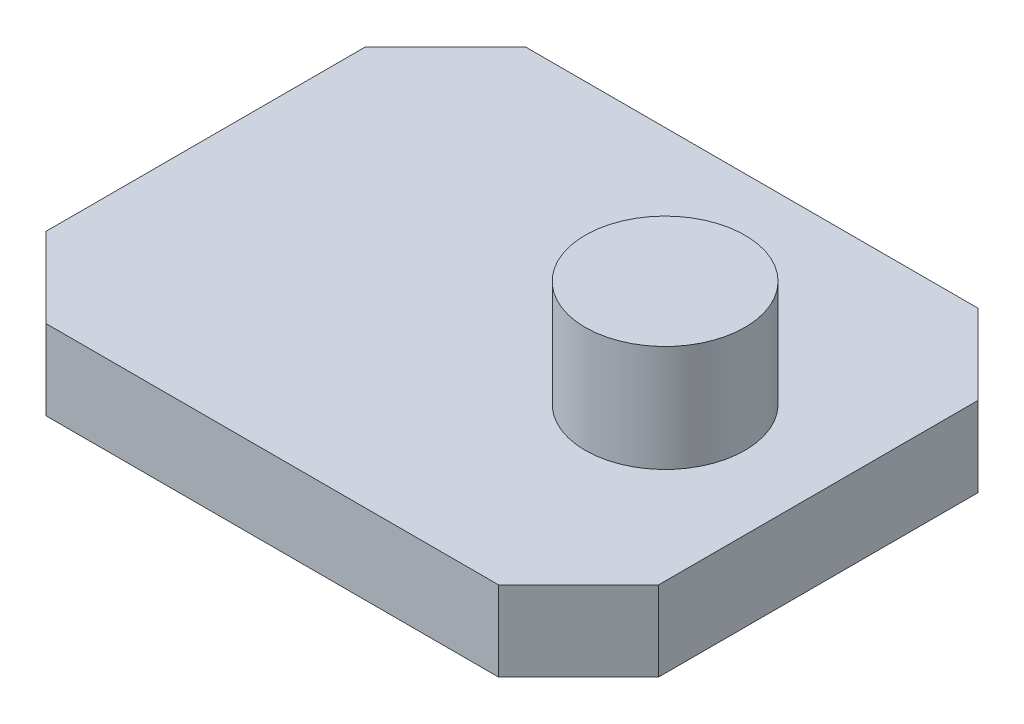
from build123d import *

# Parameters (mm, degrees)
SKETCH2_W           = 23
SKETCH2_H           = 18
BOSS_EXTRUDE1_DEPTH = 3
SKETCH3_R           = 3
BOSS_EXTRUDE2_DEPTH = 4
CHAMFER1_SIZE       = 3


with BuildPart() as part:
    # Sketch2 → Boss-Extrude1 (new body)
    with BuildSketch(Plane(origin=(0, 0, 0), x_dir=(1, 0, 0), z_dir=(0, 1, 0))):
        Rectangle(SKETCH2_W, SKETCH2_H)
    extrude(amount=BOSS_EXTRUDE1_DEPTH)

    # Sketch3 → Boss-Extrude2 (add)
    with BuildSketch(Plane(origin=(0, 3, 0), x_dir=(1, 0, 0), z_dir=(0, 1, 0))):
        with Locations(Location((5.75, 0, 0), (0, 0, 270))):
            Circle(SKETCH3_R)
    extrude(amount=BOSS_EXTRUDE2_DEPTH)

    # Chamfer1
    chamfer1_edges = [part.edges().sort_by_distance(p)[0] for p in [
        (11.5, 1.5, 9),
        (-11.5, 1.5, 9),
        (-11.5, 1.5, -9),
        (11.5, 1.5, -9),
    ]]
    chamfer(chamfer1_edges, length=CHAMFER1_SIZE)


solid = part.part
